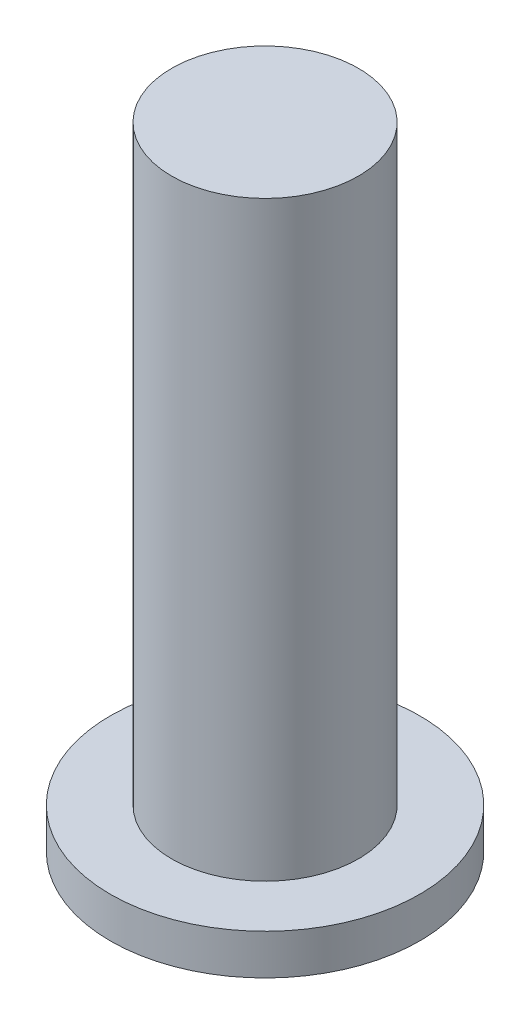
from build123d import *

# Parameters (mm, degrees)
SKETCH1_R           = 6.5
BOSS_EXTRUDE1_DEPTH = 1.7
SKETCH2_R           = 3.925
BOSS_EXTRUDE2_DEPTH = 24.85


with BuildPart() as part:
    # Sketch1 → Boss-Extrude1 (new body)
    with BuildSketch(Plane(origin=(0, 0, 0), x_dir=(1, 0, 0), z_dir=(0, 1, 0))):
        with Locations(Location((0, 0, 0), (0, 0, 270))):
            Circle(SKETCH1_R)
    extrude(amount=BOSS_EXTRUDE1_DEPTH)

    # Sketch2 → Boss-Extrude2 (add)
    with BuildSketch(Plane(origin=(0, 1.7, 0), x_dir=(1, 0, 0), z_dir=(0, 1, 0))):
        with Locations(Location((0, 0, 0), (0, 0, 270))):
            Circle(SKETCH2_R)
    extrude(amount=BOSS_EXTRUDE2_DEPTH)


solid = part.part
